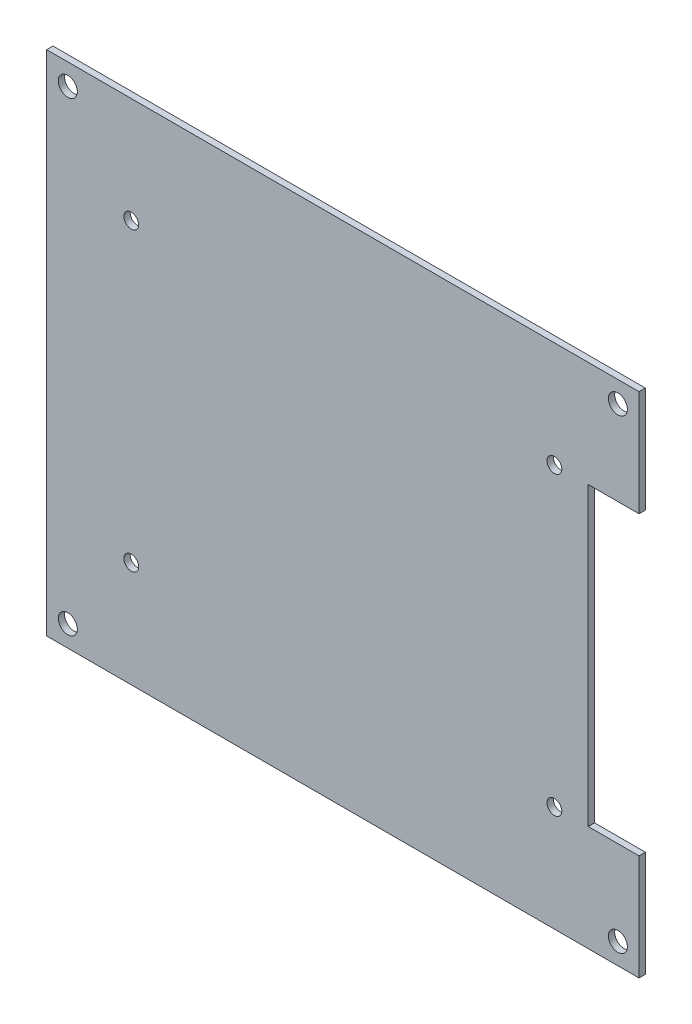
from build123d import *

# Parameters (mm, degrees)
SKETCH_1_W          = 140
SKETCH_1_H          = 120
SKETCH_1_R          = 2.25
SKETCH_1_R_2        = 1.75
EXTRUDE_1_DEPTH     = 1.5
SKETCH_2_W          = 21.124168751
SKETCH_2_H          = 70
CUT_EXTRUDE_1_DEPTH = 10


with BuildPart() as part:
    # Эскиз1 → Вытянуть1 (new body)
    with BuildSketch(Plane.XY):
        Rectangle(SKETCH_1_W, SKETCH_1_H)
        with Locations((-65, 55)):
            Circle(SKETCH_1_R, mode=Mode.SUBTRACT)
        with Locations(Location((-65, -55, 0), (0, 0, 180))):
            Circle(SKETCH_1_R, mode=Mode.SUBTRACT)
        with Locations((65, -55)):
            Circle(SKETCH_1_R, mode=Mode.SUBTRACT)
        with Locations(Location((65, 55, 0), (0, 0, 180))):
            Circle(SKETCH_1_R, mode=Mode.SUBTRACT)
        with Locations((-50, 35)):
            Circle(SKETCH_1_R_2, mode=Mode.SUBTRACT)
        with Locations(Location((-50, -35, 0), (0, 0, 180))):
            Circle(SKETCH_1_R_2, mode=Mode.SUBTRACT)
        with Locations((50, 35)):
            Circle(SKETCH_1_R_2, mode=Mode.SUBTRACT)
        with Locations(Location((50, -35, 0), (0, 0, 180))):
            Circle(SKETCH_1_R_2, mode=Mode.SUBTRACT)
    extrude(amount=EXTRUDE_1_DEPTH)

    # Эскиз2 → Вырез-Вытянуть1 (cut)
    with BuildSketch(Plane.XY.offset(1.5)):
        with Locations((68.562084376, 0)):
            Rectangle(SKETCH_2_W, SKETCH_2_H)
    extrude(amount=-CUT_EXTRUDE_1_DEPTH, mode=Mode.SUBTRACT)


solid = part.part
